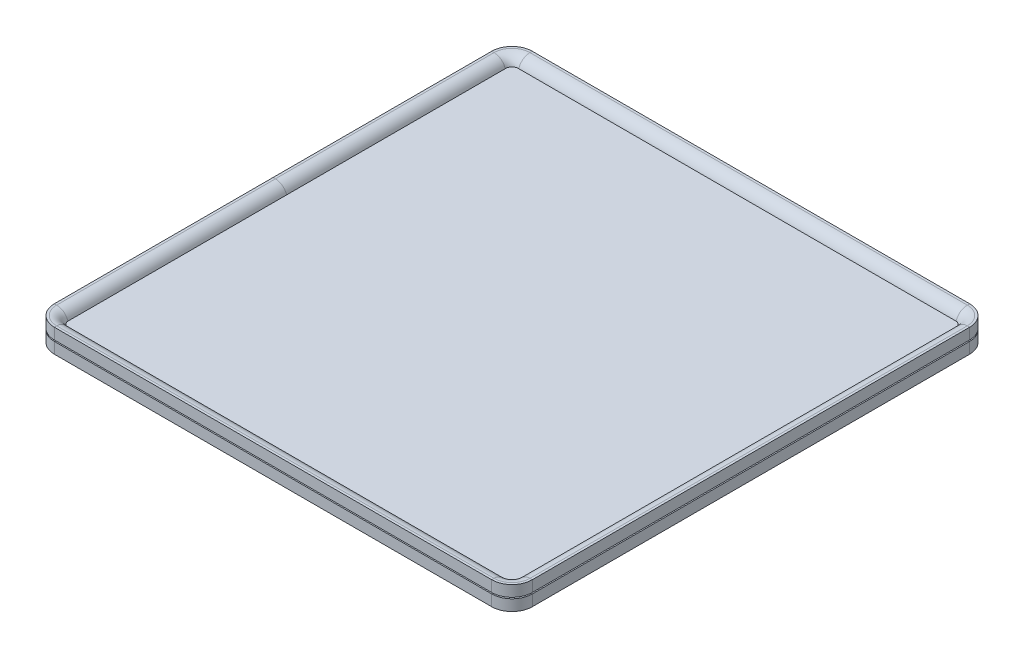
from build123d import *

# Parameters (mm, degrees)
BOSS_EXTRUDE1_DEPTH = 2.5


with BuildPart() as part:
    # Sweep1: sweep along a path in Sketch1
    with BuildLine(Plane(origin=(0, 0, 0), x_dir=(1, 0, 0), z_dir=(0, 1, 0))) as sweep1_path:
        Line((-140, 150), (140, 150))
        ThreePointArc((140, 150), (147.071067812, 147.071067812), (150, 140))
        Line((150, 140), (150, -140))
        ThreePointArc((150, -140), (147.071067812, -147.071067812), (140, -150))
        Line((140, -150), (-140, -150))
        ThreePointArc((-140, -150), (-147.071067812, -147.071067812), (-150, -140))
        Line((-150, -140), (-150, 140))
        ThreePointArc((-150, 140), (-147.071067812, 147.071067812), (-140, 150))
    # Sketch7 → Sweep1 (sweep)
    with BuildSketch(Plane.XY):
        with BuildLine():
            Line((-150, 0.4), (-150, -0.4))
            Line((-150, -0.4), (-153, -0.4))
            Line((-153, -0.4), (-153, -7.5))
            Line((-153, -7.5), (-151.5, -7.5))
            ThreePointArc((-151.5, -7.5), (-144, 0), (-151.5, 7.5))
            Line((-151.5, 7.5), (-153, 7.5))
            Line((-153, 7.5), (-153, 0.4))
            Line((-153, 0.4), (-150, 0.4))
        make_face()
    sweep(path=sweep1_path.line)


with BuildPart() as body_2:
    # Sketch8 → Boss-Extrude1 (new, symmetric)
    with BuildSketch(Plane(origin=(0, 0, 0), x_dir=(1, 0, 0), z_dir=(0, 1, 0))):
        with BuildLine():
            Line((-144, -140), (-144, 0))
            Line((-144, 0), (-144, 140))
            ThreePointArc((-144, 140), (-142.828427125, 142.828427125), (-140, 144))
            Line((-140, 144), (140, 144))
            ThreePointArc((140, 144), (142.828427125, 142.828427125), (144, 140))
            Line((144, 140), (144, -140))
            ThreePointArc((144, -140), (142.828427125, -142.828427125), (140, -144))
            Line((140, -144), (-140, -144))
            ThreePointArc((-140, -144), (-142.828427125, -142.828427125), (-144, -140))
        make_face()
    extrude(amount=BOSS_EXTRUDE1_DEPTH, both=True)


solid = Compound([part.part, body_2.part])
